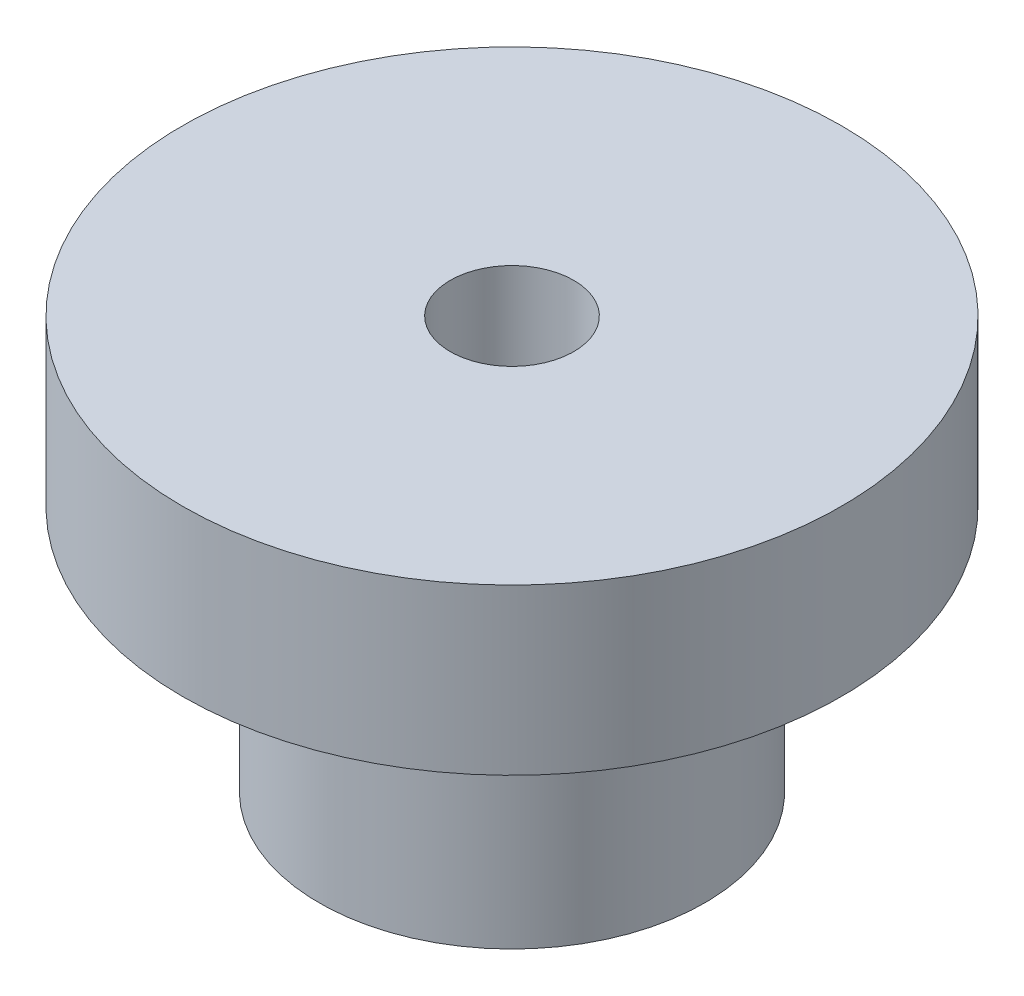
from build123d import *

# Parameters (mm, degrees)
SKETCH1_R           = 3.71475
SKETCH1_R_2         = 1.190625
BOSS_EXTRUDE1_DEPTH = 4.7625
SKETCH3_R           = 6.35
SKETCH3_R_2         = 1.190625
BOSS_EXTRUDE2_DEPTH = 3.175


with BuildPart() as part:
    # Sketch1 → Boss-Extrude1 (new body)
    with BuildSketch(Plane(origin=(0, 0, 0), x_dir=(1, 0, 0), z_dir=(0, 1, 0))):
        with Locations(Location((-27.199205157, 0, 0), (0, 0, 90))):
            Circle(SKETCH1_R)
        with Locations(Location((-27.199205157, 0, 0), (0, 0, 90))):
            Circle(SKETCH1_R_2, mode=Mode.SUBTRACT)
    extrude(amount=BOSS_EXTRUDE1_DEPTH)

    # Sketch3 → Boss-Extrude2 (add)
    with BuildSketch(Plane(origin=(0, 4.7625, 0), x_dir=(1, 0, 0), z_dir=(0, 1, 0))):
        with Locations(Location((-27.199205157, 0, 0), (0, 0, 270))):
            Circle(SKETCH3_R)
        with Locations(Location((-27.199205157, 0, 0), (0, 0, 90))):
            Circle(SKETCH3_R_2, mode=Mode.SUBTRACT)
    extrude(amount=BOSS_EXTRUDE2_DEPTH)


solid = part.part
